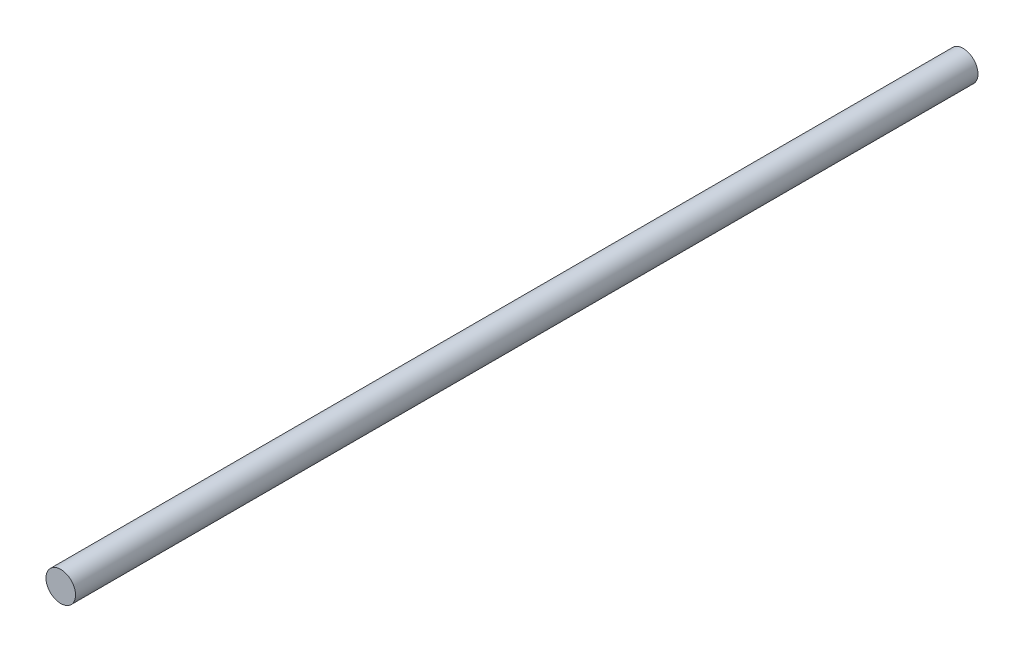
from build123d import *

# Parameters (mm, degrees)
SKETCH_1_R        = 3
EXTRUDE_220_DEPTH = 91.5


with BuildPart() as part:
    # Эскиз1 → Extrude 220 (new, symmetric)
    with BuildSketch(Plane.XY):
        Circle(SKETCH_1_R)
    extrude(amount=EXTRUDE_220_DEPTH, both=True)


solid = part.part
